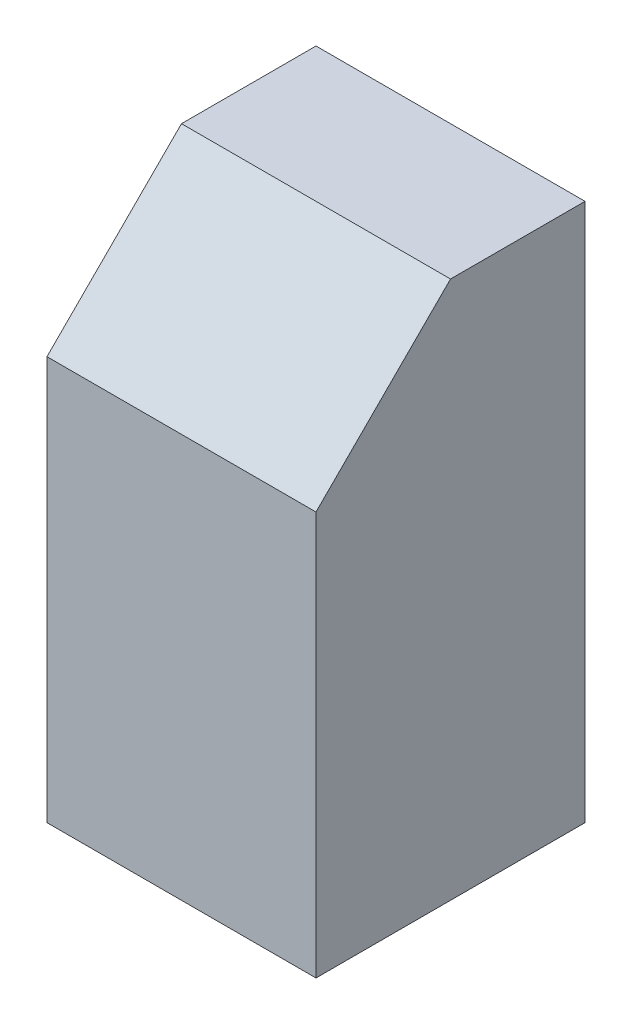
from build123d import *

# Parameters (mm, degrees)
SKETCH1_W           = 500
SKETCH1_H           = 500
BOSS_EXTRUDE1_DEPTH = 1000
CUT_EXTRUDE1_REACH  = 1147.644


with BuildPart() as part:
    # Sketch1 → Boss-Extrude1 (new body)
    with BuildSketch(Plane(origin=(0, 0, 0), x_dir=(1, 0, 0), z_dir=(0, 1, 0))):
        Rectangle(SKETCH1_W, SKETCH1_H)
    extrude(amount=BOSS_EXTRUDE1_DEPTH)

    # Sketch3 → Cut-Extrude1 (cut, up to next)
    with BuildSketch(Plane(origin=(250, 0, 0), x_dir=(0, 0, -1), z_dir=(1, 0, 0)), mode=Mode.PRIVATE) as cut_extrude1_sk1:
        Polygon((-250, 750), (0, 1000), (-250, 1000), align=None)
    cut_extrude1_tool1 = extrude(cut_extrude1_sk1.sketch, amount=-CUT_EXTRUDE1_REACH, mode=Mode.PRIVATE) & part.part
    add(cut_extrude1_tool1.solids().sort_by_distance((250, 916.666667, 166.666667))[0], mode=Mode.SUBTRACT)


solid = part.part
